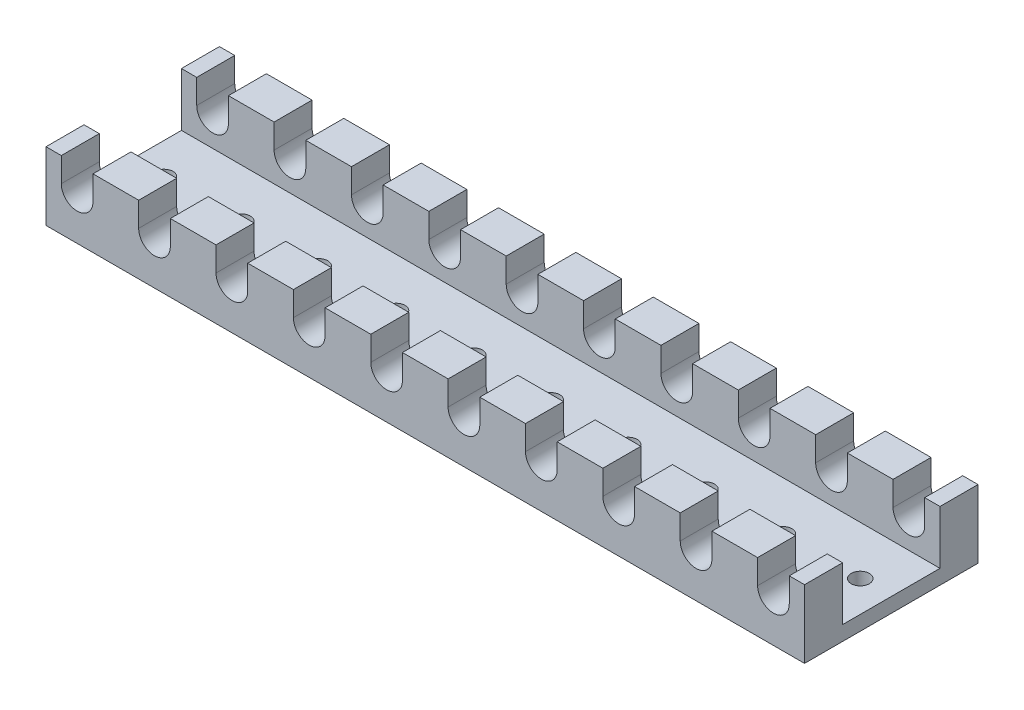
from build123d import *

# Parameters (mm, degrees)
SKETCH1_W           = 155.7
SKETCH1_H           = 35.6
BOSS_EXTRUDE1_DEPTH = 14
SKETCH3_R           = 1.85
CUT_EXTRUDE1_DEPTH  = 82.076892516
SKETCH4_W           = 20
SKETCH4_H           = 11
CUT_EXTRUDE2_DEPTH  = 158.338266166
CUT_EXTRUDE3_DEPTH  = 87.740892894


with BuildPart() as part:
    # Sketch1 → Boss-Extrude1 (new body)
    with BuildSketch(Plane(origin=(0, 0, 0), x_dir=(1, 0, 0), z_dir=(0, 1, 0))):
        Rectangle(SKETCH1_W, SKETCH1_H)
    extrude(amount=BOSS_EXTRUDE1_DEPTH)

    # Sketch3 → Cut-Extrude1 (cut, through all)
    with BuildSketch(Plane(origin=(0, 14, 0), x_dir=(1, 0, 0), z_dir=(0, 1, 0))):
        with Locations(Location((-71.4375, 0, 0), (0, 0, 270))):
            Circle(SKETCH3_R)
        with Locations(Location((-55.5575, 0, 0), (0, 0, 270))):
            Circle(SKETCH3_R)
        with Locations(Location((-39.6775, 0, 0), (0, 0, 270))):
            Circle(SKETCH3_R)
        with Locations(Location((-23.7975, 0, 0), (0, 0, 270))):
            Circle(SKETCH3_R)
        with Locations(Location((-7.9175, 0, 0), (0, 0, 270))):
            Circle(SKETCH3_R)
        with Locations(Location((7.9625, 0, 0), (0, 0, 270))):
            Circle(SKETCH3_R)
        with Locations(Location((23.8425, 0, 0), (0, 0, 270))):
            Circle(SKETCH3_R)
        with Locations(Location((39.7225, 0, 0), (0, 0, 270))):
            Circle(SKETCH3_R)
        with Locations(Location((55.6025, 0, 0), (0, 0, 270))):
            Circle(SKETCH3_R)
        with Locations(Location((71.4825, 0, 0), (0, 0, 270))):
            Circle(SKETCH3_R)
    extrude(amount=-CUT_EXTRUDE1_DEPTH, mode=Mode.SUBTRACT)

    # Sketch4 → Cut-Extrude2 (cut, through all)
    with BuildSketch(Plane.ZY.offset(77.85)):
        with Locations((0, 8.5)):
            Rectangle(SKETCH4_W, SKETCH4_H)
    extrude(amount=-CUT_EXTRUDE2_DEPTH, mode=Mode.SUBTRACT)

    # Sketch5 → Cut-Extrude3 (cut, through all)
    with BuildSketch(Plane.XY.offset(17.8)):
        with BuildLine():
            Line((-74.71, 9), (-74.71, 15))
            Line((-74.71, 15), (-68.21, 15))
            Line((-68.21, 15), (-68.21, 9))
            ThreePointArc((-68.21, 9), (-71.46, 5.75), (-74.71, 9))
        make_face()
        with BuildLine():
            Line((-52.33, 15), (-52.33, 9))
            ThreePointArc((-52.33, 9), (-55.58, 5.75), (-58.83, 9))
            Line((-58.83, 9), (-58.83, 15))
            Line((-58.83, 15), (-52.33, 15))
        make_face()
        with BuildLine():
            Line((-36.45, 15), (-36.45, 9))
            ThreePointArc((-36.45, 9), (-39.7, 5.75), (-42.95, 9))
            Line((-42.95, 9), (-42.95, 15))
            Line((-42.95, 15), (-36.45, 15))
        make_face()
        with BuildLine():
            Line((-20.57, 15), (-20.57, 9))
            ThreePointArc((-20.57, 9), (-23.82, 5.75), (-27.07, 9))
            Line((-27.07, 9), (-27.07, 15))
            Line((-27.07, 15), (-20.57, 15))
        make_face()
        with BuildLine():
            Line((-4.69, 15), (-4.69, 9))
            ThreePointArc((-4.69, 9), (-7.94, 5.75), (-11.19, 9))
            Line((-11.19, 9), (-11.19, 15))
            Line((-11.19, 15), (-4.69, 15))
        make_face()
        with BuildLine():
            Line((11.19, 15), (11.19, 9))
            ThreePointArc((11.19, 9), (7.94, 5.75), (4.69, 9))
            Line((4.69, 9), (4.69, 15))
            Line((4.69, 15), (11.19, 15))
        make_face()
        with BuildLine():
            Line((27.07, 15), (27.07, 9))
            ThreePointArc((27.07, 9), (23.82, 5.75), (20.57, 9))
            Line((20.57, 9), (20.57, 15))
            Line((20.57, 15), (27.07, 15))
        make_face()
        with BuildLine():
            Line((42.95, 15), (42.95, 9))
            ThreePointArc((42.95, 9), (39.7, 5.75), (36.45, 9))
            Line((36.45, 9), (36.45, 15))
            Line((36.45, 15), (42.95, 15))
        make_face()
        with BuildLine():
            Line((58.83, 15), (58.83, 9))
            ThreePointArc((58.83, 9), (55.58, 5.75), (52.33, 9))
            Line((52.33, 9), (52.33, 15))
            Line((52.33, 15), (58.83, 15))
        make_face()
        with BuildLine():
            Line((74.71, 15), (74.71, 9))
            ThreePointArc((74.71, 9), (71.46, 5.75), (68.21, 9))
            Line((68.21, 9), (68.21, 15))
            Line((68.21, 15), (74.71, 15))
        make_face()
    extrude(amount=-CUT_EXTRUDE3_DEPTH, mode=Mode.SUBTRACT)


solid = part.part
